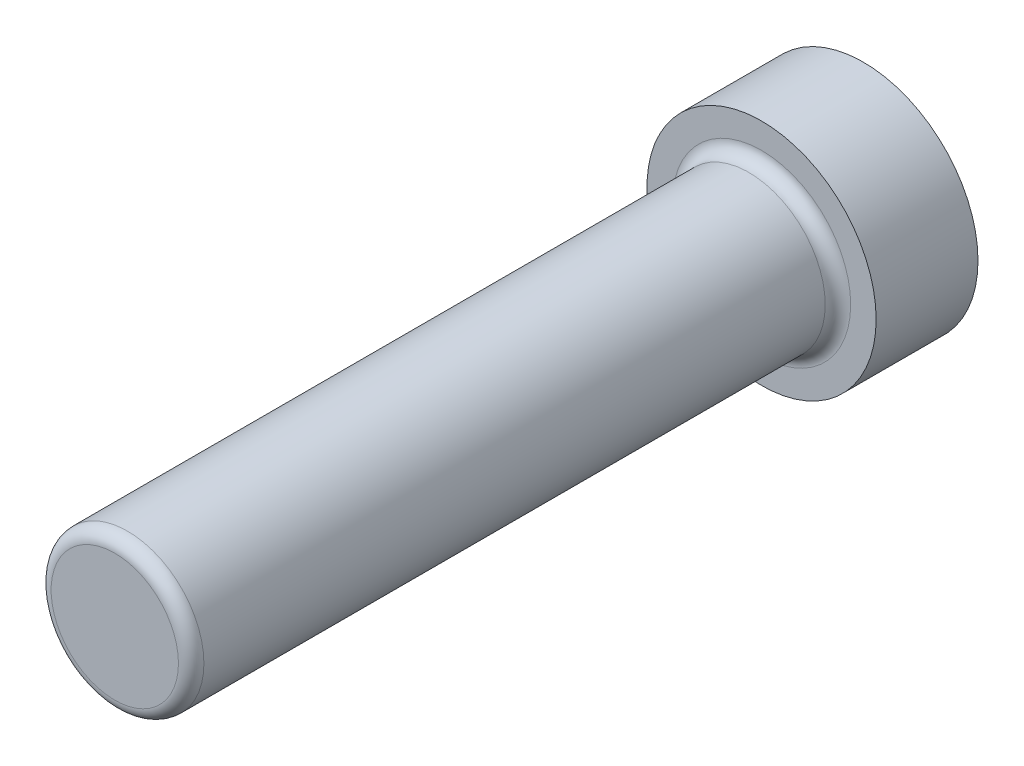
from build123d import *

# Parameters (mm, degrees)
SKETCH1_R           = 1.5
BOSS_EXTRUDE1_DEPTH = 12.7
SKETCH3_R           = 2.25
BOSS_EXTRUDE2_DEPTH = 2
FILLET2_R           = 0.25
FILLET3_R           = 0.25


with BuildPart() as part:
    # Sketch1 → Boss-Extrude1 (new body)
    with BuildSketch(Plane.XY):
        Circle(SKETCH1_R)
    extrude(amount=BOSS_EXTRUDE1_DEPTH)

    # Sketch3 → Boss-Extrude2 (add)
    with BuildSketch(Plane.XY):
        Circle(SKETCH3_R)
    extrude(amount=-BOSS_EXTRUDE2_DEPTH)

    # Fillet2
    fillet2_edges = [part.edges().sort_by_distance(p)[0] for p in [
        (-1.5, 0, 12.7),
    ]]
    fillet(fillet2_edges, radius=FILLET2_R)

    # Fillet3
    fillet3_edges = [part.edges().sort_by_distance(p)[0] for p in [
        (-1.5, 0, 0),
    ]]
    fillet(fillet3_edges, radius=FILLET3_R)


solid = part.part
